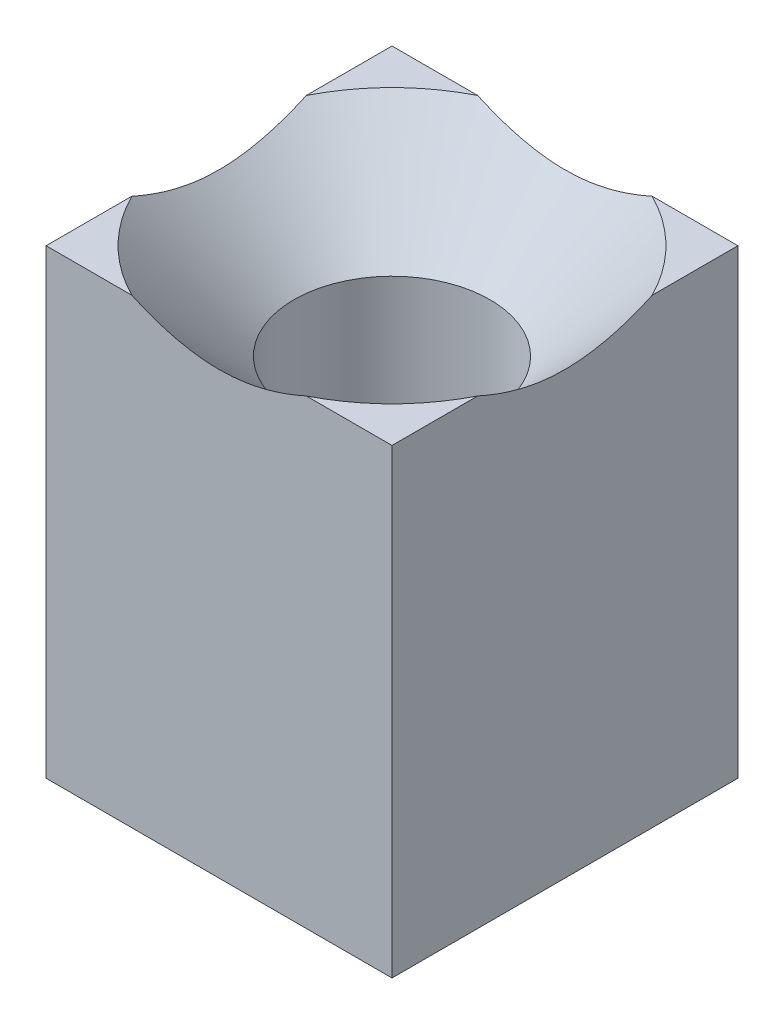
from build123d import *

# Parameters (mm, degrees)
SKETCH1_W                     = 6
SKETCH1_H                     = 6
SKETCH1_R                     = 1.5
BOSS_EXTRUDE1_DEPTH           = 8
CSK_FOR_M3_SFHCS1_D           = 3.4
CSK_FOR_M3_SFHCS1_DEPTH       = 11.3
CSK_FOR_M3_SFHCS1_CSINK_D     = 6.72
CSK_FOR_M3_SFHCS1_CSINK_ANGLE = 90
CSK_FOR_M3_SFHCS1_TIP         = 1.021463052


with BuildPart() as part:
    # Sketch1 → Boss-Extrude1 (new body)
    with BuildSketch(Plane(origin=(0, 0, 0), x_dir=(1, 0, 0), z_dir=(0, 1, 0))):
        Rectangle(SKETCH1_W, SKETCH1_H)
        with Locations(Location((0, 0, 0), (0, 0, 270))):
            Circle(SKETCH1_R, mode=Mode.SUBTRACT)
    extrude(amount=BOSS_EXTRUDE1_DEPTH)

    # CSK for M3 SFHCS1
    with Locations(Plane(origin=(0, 8, 0), x_dir=(1, 0, 0), z_dir=(0, 1, 0))):
        with Locations((0, 0)):
            CounterSinkHole(CSK_FOR_M3_SFHCS1_D / 2, CSK_FOR_M3_SFHCS1_CSINK_D / 2, depth=CSK_FOR_M3_SFHCS1_DEPTH, counter_sink_angle=CSK_FOR_M3_SFHCS1_CSINK_ANGLE)
            with Locations((0, 0, -(CSK_FOR_M3_SFHCS1_DEPTH + CSK_FOR_M3_SFHCS1_TIP / 2))):  # 118° drill point
                Cone(0, CSK_FOR_M3_SFHCS1_D / 2, CSK_FOR_M3_SFHCS1_TIP, mode=Mode.SUBTRACT)


solid = part.part
